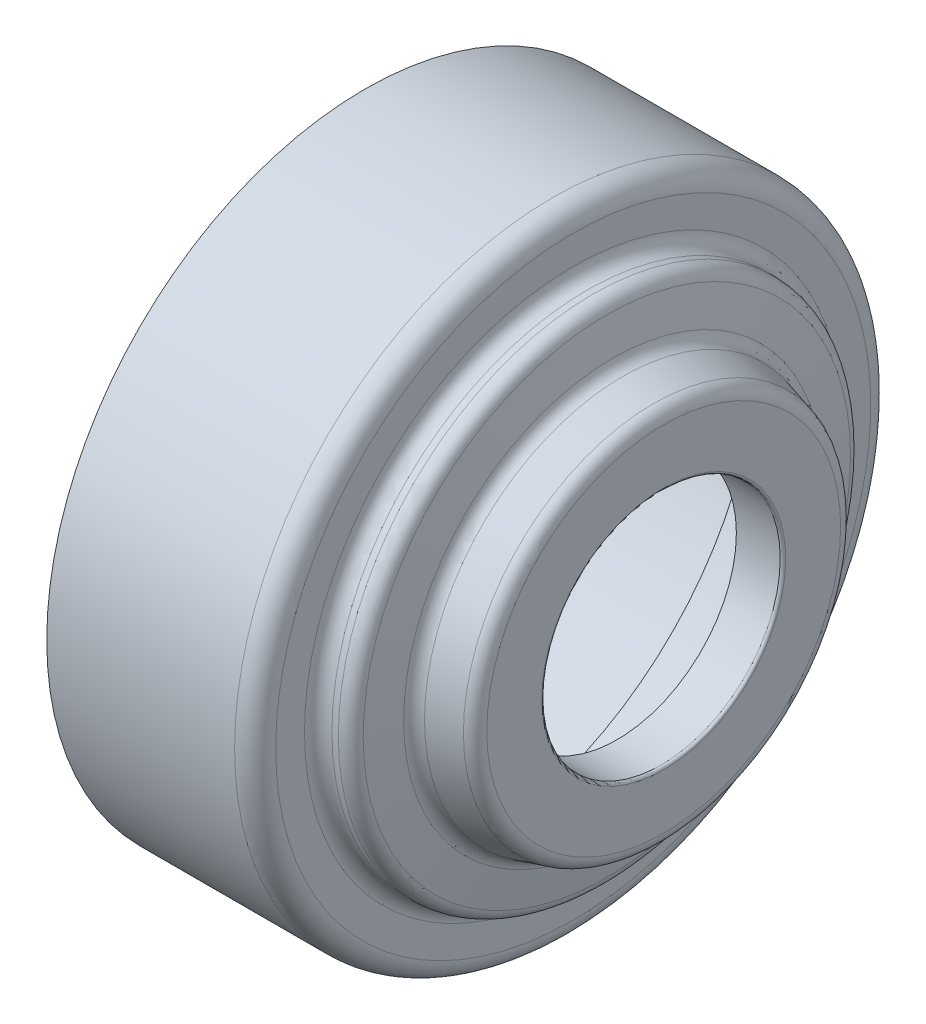
from build123d import *

# Parameters (mm, degrees)
FILLET_1_R = 0.2
FILLET_2_R = 1
FILLET_3_R = 1.5


with BuildPart() as part:
    # 草图2 → 旋转1 (revolve)
    with BuildSketch(Plane.XY, mode=Mode.PRIVATE) as revolve_1_sk:
        Polygon((-14, 22), (-6.9, 22), (-6.9, 21.6), (0, 21.6), (0, 17.4), (2.5, 17.4), (3.157262574, 13.672478713), (6.6, 12.75), (6.6, 9.4), (4.4, 9.4), (4.4, 8.7), (7.8, 8.7), (7.8, 13.670792386), (4.20628057, 14.633726605), (3.506919557, 18.6), (1.2, 18.6), (1.2, 23.2), (-14, 23.2), align=None)
    revolve(revolve_1_sk.sketch.rotate(Axis((-36.936605317, 0, 0), (1, 0, 0)), 90), axis=Axis((-36.936605317, 0, 0), (1, 0, 0)))

    # 圆角1
    fillet_1_edges = [part.edges().sort_by_distance(p)[0] for p in [
        (0, 0, -21.6),
        (0, 0, -17.4),
        (2.5, 0, -17.4),
        (6.6, 0, -12.75),
        (7.8, 0, -8.7),
    ]]
    fillet(fillet_1_edges, radius=FILLET_1_R)

    # 圆角2
    fillet_2_edges = [part.edges().sort_by_distance(p)[0] for p in [
        (7.8, 0, -13.670792386),
        (4.20628057, 0, -14.633726605),
        (3.506919557, 0, -18.6),
        (1.2, 0, -18.6),
    ]]
    fillet(fillet_2_edges, radius=FILLET_2_R)

    # 圆角3
    fillet_3_edges = [part.edges().sort_by_distance(p)[0] for p in [
        (3.157262574, 0, -13.672478713),
        (1.2, 0, -23.2),
    ]]
    fillet(fillet_3_edges, radius=FILLET_3_R)


solid = part.part
